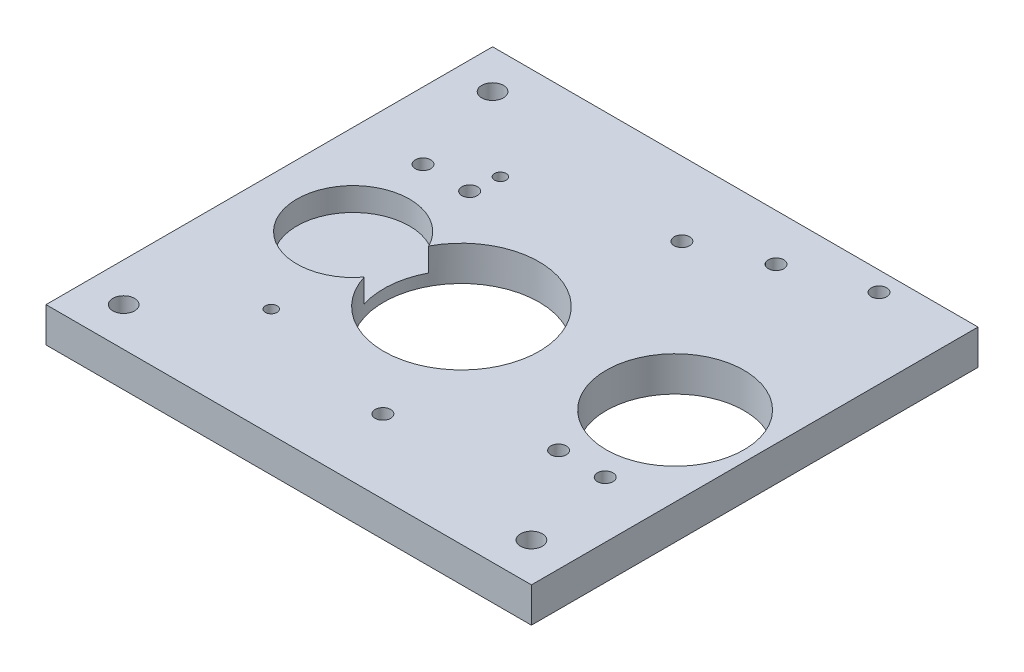
from build123d import *

# Parameters (mm, degrees)
SKETCH1_W                            = 125
SKETCH1_H                            = 115
TOP_BASE_DEPTH                       = 9
SKETCH5_R                            = 14.5
DRIVE_GEAR_EXTRUDE_CUT_DEPTH         = 6
SKETCH17_R                           = 20
INTERMEDIATE_GEAR_TOP_PART_CUT_DEPTH = 171.091152033
SKETCH8_R                            = 17.75
THUMB_EXTRUDE_CUT_DEPTH              = 171.091152033
SKETCH26_R                           = 1.5
STRING_HOLES_DEPTH                   = 171.091152033
THUMB_MOUNT_HOLES_R                  = 2
THUMB_MOUNT_HOLES_M4_DEPTH           = 171.091152033
FINGERS_MOUNT_HOLES_R                = 2
FINGERS_MOUNT_HOLES_M4_DEPTH         = 171.091152033
CONNECT_HOLES_POSITION_R             = 2.8
CONNECT_HOLES_M6_DEPTH               = 171.091152033
SKETCH27_R                           = 3.75
XL320_NUT_M4_DEPTH                   = 4


with BuildPart() as part:
    # Sketch1 → Top_Base (new body)
    with BuildSketch(Plane(origin=(0, 0, 0), x_dir=(1, 0, 0), z_dir=(0, 1, 0))):
        with Locations((62.5, 57.5)):
            Rectangle(SKETCH1_W, SKETCH1_H)
    extrude(amount=TOP_BASE_DEPTH)

    # Sketch5 → Drive_Gear_Extrude_Cut (cut)
    with BuildSketch(Plane(origin=(0, 9, 0), x_dir=(1, 0, 0), z_dir=(0, 1, 0))):
        with Locations(Location((23.25, 55.841914565, 0), (0, 0, 270))):
            Circle(SKETCH5_R)
    extrude(amount=-DRIVE_GEAR_EXTRUDE_CUT_DEPTH, mode=Mode.SUBTRACT)

    # Sketch17 → Intermediate_Gear_Top_Part_Cut (cut, through all)
    with BuildSketch(Plane(origin=(0, 9, 0), x_dir=(1, 0, 0), z_dir=(0, 1, 0))):
        with Locations(Location((53.923140352, 53.049342105, 0), (0, 0, 270))):
            Circle(SKETCH17_R)
    extrude(amount=-INTERMEDIATE_GEAR_TOP_PART_CUT_DEPTH, mode=Mode.SUBTRACT)

    # Sketch8 → Thumb_Extrude_Cut (cut, through all)
    with BuildSketch(Plane(origin=(0, 9, 0), x_dir=(1, 0, 0), z_dir=(0, 1, 0))):
        with Locations(Location((104.5, 57.5, 0), (0, 0, 270))):
            Circle(SKETCH8_R)
    extrude(amount=-THUMB_EXTRUDE_CUT_DEPTH, mode=Mode.SUBTRACT)

    # Sketch26 → String_Holes (cut, through all)
    with BuildSketch(Plane.XZ):
        with Locations(Location((30, -28, 0), (0, 0, 270))):
            Circle(SKETCH26_R)
        with Locations(Location((30, -87, 0), (0, 0, 90))):
            Circle(SKETCH26_R)
    extrude(amount=-STRING_HOLES_DEPTH, mode=Mode.SUBTRACT)

    # Thumb_Mount_Holes → Thumb_Mount_Holes_(M4) (cut, through all)
    with BuildSketch(Plane(origin=(0, 9, 0), x_dir=(1, 0, 0), z_dir=(0, 1, 0))):
        with Locations(Location((104.5, 110, 0), (0, 0, 270))):
            Circle(THUMB_MOUNT_HOLES_R)
        with Locations(Location((85, 103, 0), (0, 0, 270))):
            Circle(THUMB_MOUNT_HOLES_R)
        with Locations(Location((110.5, 33.5, 0), (0, 0, 270))):
            Circle(THUMB_MOUNT_HOLES_R)
        with Locations(Location((98.5, 33.5, 0), (0, 0, 90))):
            Circle(THUMB_MOUNT_HOLES_R)
    extrude(amount=-THUMB_MOUNT_HOLES_M4_DEPTH, mode=Mode.SUBTRACT)

    # Fingers_Mount_Holes → Fingers_Mount_Holes_(M4) (cut, through all)
    with BuildSketch(Plane(origin=(0, 9, 0), x_dir=(1, 0, 0), z_dir=(0, 1, 0))):
        with Locations(Location((67.75, 96, 0), (0, 0, 270))):
            Circle(FINGERS_MOUNT_HOLES_R)
        with Locations(Location((67.75, 19, 0), (0, 0, 90))):
            Circle(FINGERS_MOUNT_HOLES_R)
        with Locations(Location((17.25, 79.841914565, 0), (0, 0, 270))):
            Circle(FINGERS_MOUNT_HOLES_R)
        with Locations(Location((29.25, 79.841914565, 0), (0, 0, 90))):
            Circle(FINGERS_MOUNT_HOLES_R)
    extrude(amount=-FINGERS_MOUNT_HOLES_M4_DEPTH, mode=Mode.SUBTRACT)

    # Connect_Holes_Position → Connect_Holes_(M6) (cut, through all)
    with BuildSketch(Plane(origin=(0, 9, 0), x_dir=(1, 0, 0), z_dir=(0, 1, 0))):
        with Locations(Location((10, 105, 0), (0, 0, 270))):
            Circle(CONNECT_HOLES_POSITION_R)
        with Locations(Location((115, 10, 0), (0, 0, 270))):
            Circle(CONNECT_HOLES_POSITION_R)
        with Locations(Location((10, 10, 0), (0, 0, 270))):
            Circle(CONNECT_HOLES_POSITION_R)
    extrude(amount=-CONNECT_HOLES_M6_DEPTH, mode=Mode.SUBTRACT)

    # Sketch27 → XL320_Nut_(M4) (cut)
    with BuildSketch(Plane.XZ):
        with Locations(Location((29.25, -79.841914565, 0), (0, 0, 270))):
            Circle(SKETCH27_R)
        with Locations(Location((17.25, -79.841914565, 0), (0, 0, 270))):
            Circle(SKETCH27_R)
    extrude(amount=-XL320_NUT_M4_DEPTH, mode=Mode.SUBTRACT)


solid = part.part
